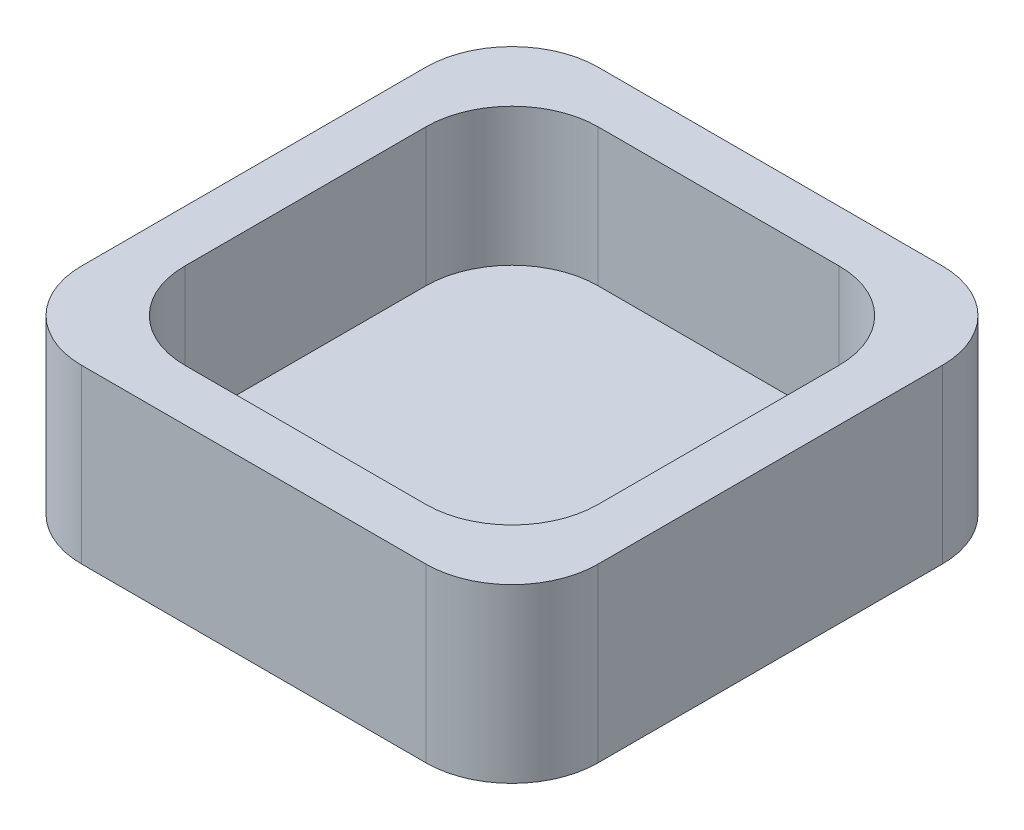
from build123d import *

# Parameters (mm, degrees)
SKETCH2_W           = 30
SKETCH2_H           = 30
BOSS_EXTRUDE1_DEPTH = 10
SKETCH4_W           = 24
SKETCH4_H           = 24
CUT_EXTRUDE1_DEPTH  = 8
FILLET1_R           = 5
FILLET2_R           = 5


with BuildPart() as part:
    # Sketch2 → Boss-Extrude1 (new body)
    with BuildSketch(Plane(origin=(0, 0, 0), x_dir=(1, 0, 0), z_dir=(0, 1, 0))):
        with Locations((-15, -15)):
            Rectangle(SKETCH2_W, SKETCH2_H)
    extrude(amount=BOSS_EXTRUDE1_DEPTH)

    # Sketch4 → Cut-Extrude1 (cut)
    with BuildSketch(Plane(origin=(0, 10, 0), x_dir=(1, 0, 0), z_dir=(0, 1, 0))):
        with Locations((-15, -15)):
            Rectangle(SKETCH4_W, SKETCH4_H)
    extrude(amount=-CUT_EXTRUDE1_DEPTH, mode=Mode.SUBTRACT)

    # Fillet1
    fillet1_edges = [part.edges().sort_by_distance(p)[0] for p in [
        (0, 5, 30),
        (-30, 5, 30),
        (-30, 5, 0),
        (0, 5, 0),
    ]]
    fillet(fillet1_edges, radius=FILLET1_R)

    # Fillet2
    fillet2_edges = [part.edges().sort_by_distance(p)[0] for p in [
        (-27, 6, 27),
        (-27, 6, 3),
        (-3, 6, 3),
        (-3, 6, 27),
    ]]
    fillet(fillet2_edges, radius=FILLET2_R)


solid = part.part
